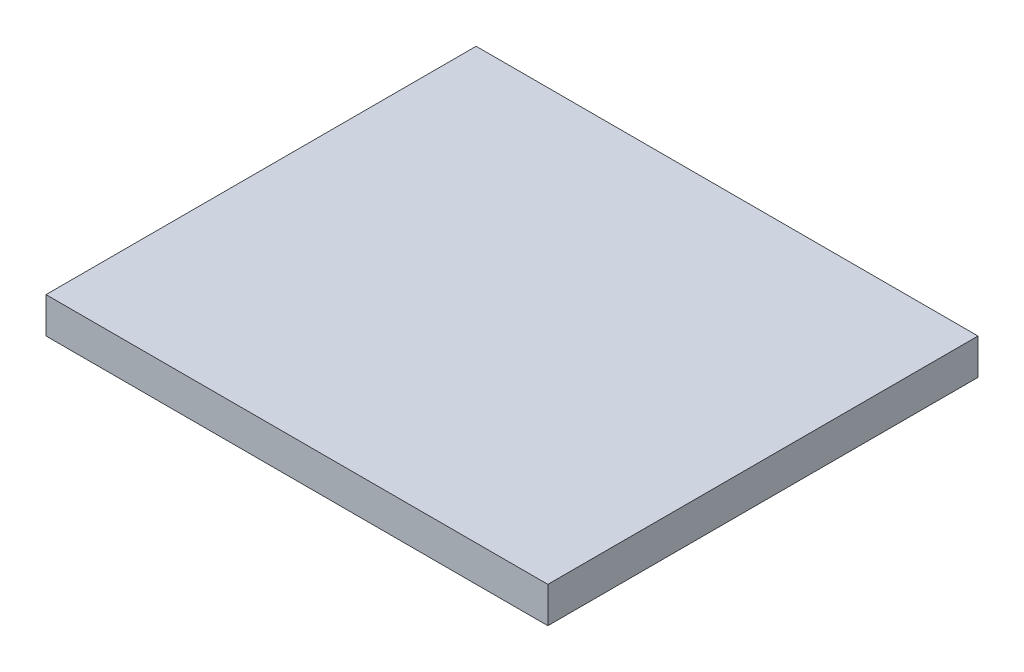
from build123d import *

# Parameters (mm, degrees)
SKETCH1_W           = 3.5
SKETCH1_H           = 3
BOSS_EXTRUDE1_DEPTH = 0.125


with BuildPart() as part:
    # Sketch1 → Boss-Extrude1 (new, symmetric)
    with BuildSketch(Plane(origin=(0, 0, 0), x_dir=(1, 0, 0), z_dir=(0, 1, 0))):
        Rectangle(SKETCH1_W, SKETCH1_H)
    extrude(amount=BOSS_EXTRUDE1_DEPTH, both=True)


solid = part.part
